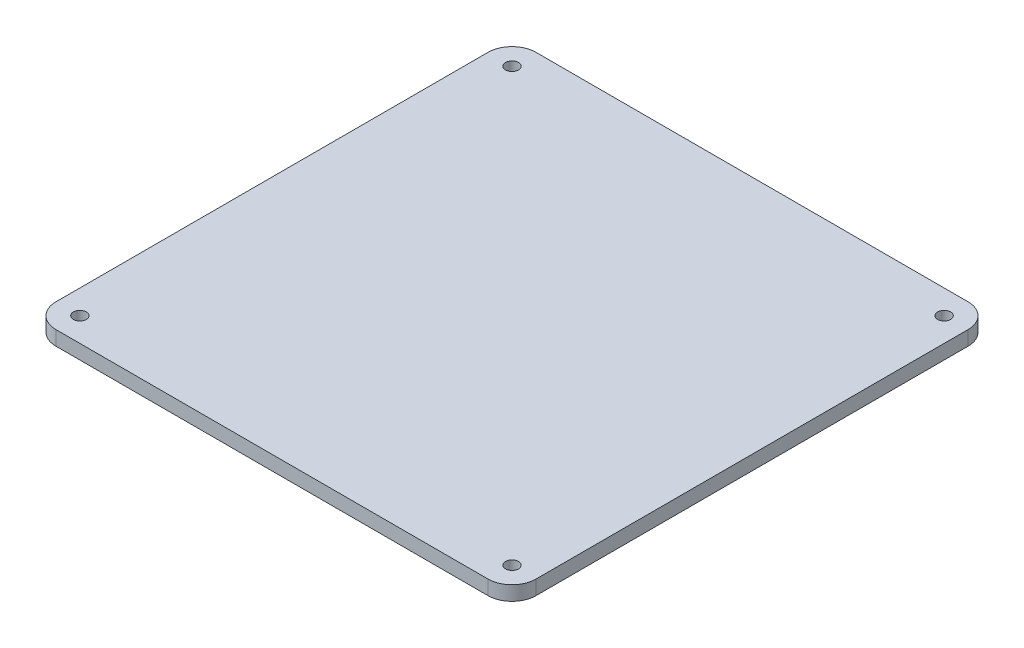
from build123d import *

# Parameters (mm, degrees)
SKETCH1_W                   = 200
SKETCH1_H                   = 200
BOSS_EXTRUDE1_DEPTH         = 6
FILLET1_R                   = 10
TAP_DRILL_FOR_1_4_28_TAP1_D = 5.4102


with BuildPart() as part:
    # Sketch1 → Boss-Extrude1 (new body)
    with BuildSketch(Plane(origin=(0, 0, 0), x_dir=(1, 0, 0), z_dir=(0, 1, 0))):
        Rectangle(SKETCH1_W, SKETCH1_H)
    extrude(amount=BOSS_EXTRUDE1_DEPTH)

    # Fillet1
    fillet1_edges = [part.edges().sort_by_distance(p)[0] for p in [
        (100, 3, 100),
        (-100, 3, 100),
        (-100, 3, -100),
        (100, 3, -100),
    ]]
    fillet(fillet1_edges, radius=FILLET1_R)

    # Tap Drill for 1/4-28 Tap1 (through all)
    with Locations(Plane(origin=(0, 6, 0), x_dir=(1, 0, 0), z_dir=(0, 1, 0))):
        with Locations((-90, 90), (90, 90), (90, -90), (-90, -90)):
            Hole(TAP_DRILL_FOR_1_4_28_TAP1_D / 2)


solid = part.part
